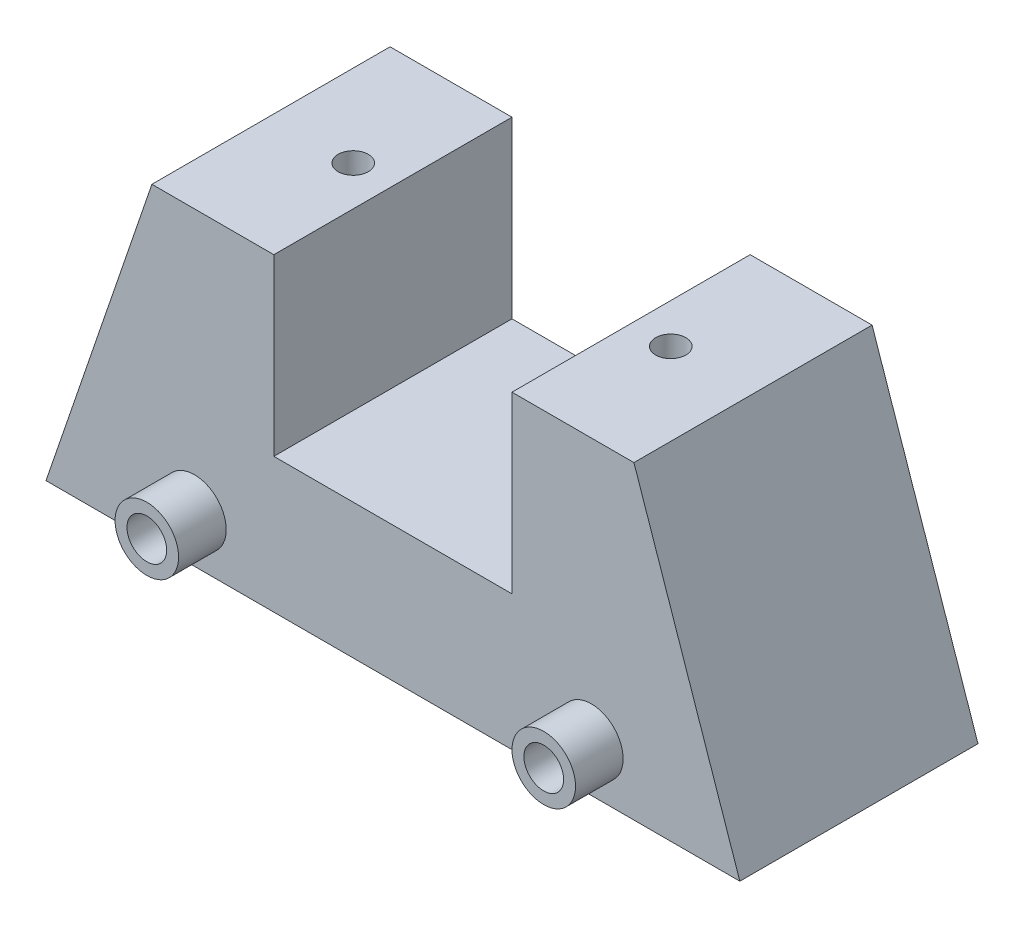
from build123d import *

# Parameters (mm, degrees)
SKETCH1_W           = 87.4
SKETCH1_H           = 39
BOSS_EXTRUDE1_DEPTH = 30
CUT_EXTRUDE1_START  = -4
CUT_EXTRUDE1_DEPTH  = 22
SKETCH3_W           = 30
SKETCH3_H           = 22
CUT_EXTRUDE2_DEPTH  = 66.80797824
SKETCH4_R           = 1.9
CUT_EXTRUDE3_DEPTH  = 15
SKETCH5_R           = 4
BOSS_EXTRUDE2_DEPTH = 6
SKETCH6_R           = 2.5
CUT_EXTRUDE4_DEPTH  = 10


with BuildPart() as part:
    # Sketch1 → Boss-Extrude1 (new body)
    with BuildSketch(Plane.XY):
        with Locations((0, 19.5)):
            Rectangle(SKETCH1_W, SKETCH1_H)
    extrude(amount=BOSS_EXTRUDE1_DEPTH)

    # Sketch2 → Cut-Extrude1 (cut)
    with BuildSketch(Plane.XY.offset(30).offset(CUT_EXTRUDE1_START)):
        with BuildLine():
            Line((-38.667900264, 0), (38.667900264, 0))
            Line((38.667900264, 0), (37.107871406, 4.560366948))
            ThreePointArc((37.107871406, 4.560366948), (33.096716485, 9.948855693), (26.7, 12))
            Line((26.7, 12), (-26.7, 12))
            ThreePointArc((-26.7, 12), (-33.096716485, 9.948855693), (-37.107871406, 4.560366948))
            Line((-37.107871406, 4.560366948), (-38.667900264, 0))
        make_face()
    extrude(amount=-CUT_EXTRUDE1_DEPTH, mode=Mode.SUBTRACT)

    # Sketch3 → Cut-Extrude2 (cut, through all)
    with BuildSketch(Plane.XY.offset(30)):
        Polygon((-43.7, 0), (-30.358721505, 39), (-43.7, 39), align=None)
        with Locations((0, 28)):
            Rectangle(SKETCH3_W, SKETCH3_H)
        Polygon((30.358721505, 39), (43.7, 0), (43.7, 39), align=None)
    extrude(amount=-CUT_EXTRUDE2_DEPTH, mode=Mode.SUBTRACT)

    # Sketch4 → Cut-Extrude3 (cut)
    with BuildSketch(Plane(origin=(0, 39, 0), x_dir=(1, 0, 0), z_dir=(0, 1, 0))):
        with Locations(Location((-20, -15, 0), (0, 0, 180))):
            Circle(SKETCH4_R)
        with Locations(Location((20, -15, 0), (0, 0, 180))):
            Circle(SKETCH4_R)
    extrude(amount=-CUT_EXTRUDE3_DEPTH, mode=Mode.SUBTRACT)

    # Sketch5 → Boss-Extrude2 (add)
    with BuildSketch(Plane.XY.offset(30)):
        with Locations(Location((25, 6, 0), (0, 0, 180))):
            Circle(SKETCH5_R)
        with Locations(Location((-25, 6, 0), (0, 0, 180))):
            Circle(SKETCH5_R)
    extrude(amount=BOSS_EXTRUDE2_DEPTH)

    # Sketch6 → Cut-Extrude4 (cut)
    with BuildSketch(Plane.XY.offset(36)):
        with Locations((25, 6)):
            Circle(SKETCH6_R)
        with Locations((-25, 6)):
            Circle(SKETCH6_R)
    extrude(amount=-CUT_EXTRUDE4_DEPTH, mode=Mode.SUBTRACT)


solid = part.part
